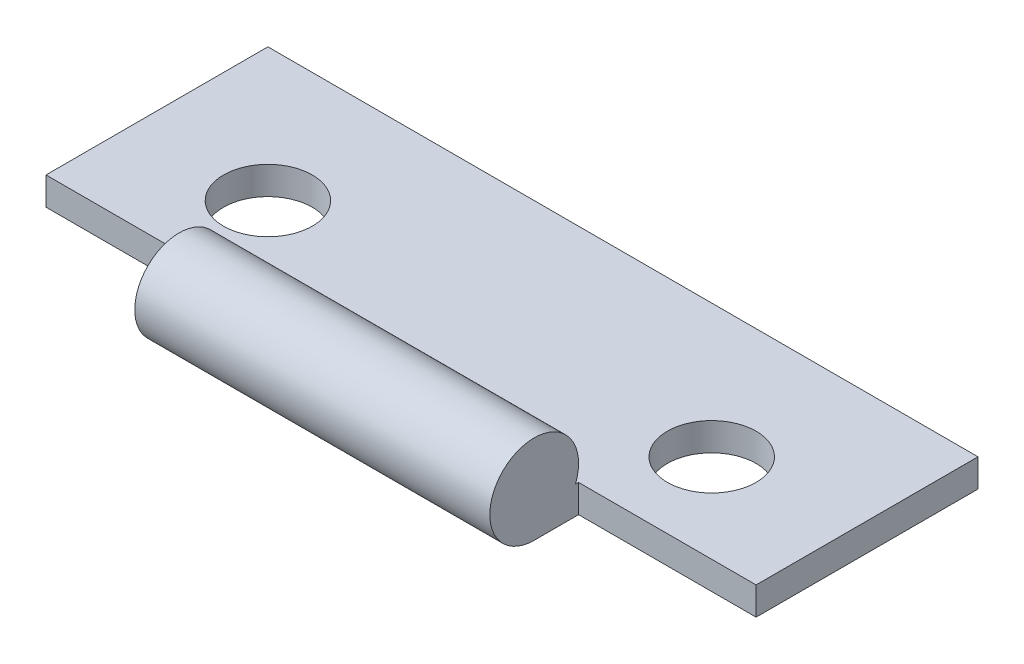
from build123d import *

# Parameters (mm, degrees)
SKETCH1_R           = 1.5875
BOSS_EXTRUDE1_DEPTH = 1
SKETCH2_R           = 1.5875
BOSS_EXTRUDE2_DEPTH = 12.7


with BuildPart() as part:
    # Sketch1 → Boss-Extrude1 (new body)
    with BuildSketch(Plane(origin=(0, 0, 0), x_dir=(1, 0, 0), z_dir=(0, 1, 0))):
        Polygon((25.4, 9.525), (25.4, 1.5875), (19.05, 1.5875), (19.05, 0), (6.35, 0), (6.35, 1.5875), (0, 1.5875), (0, 9.525), align=None)
        with Locations(Location((4.7625, 4.7625, 0), (0, 0, 270))):
            Circle(SKETCH1_R, mode=Mode.SUBTRACT)
        with Locations(Location((20.6375, 4.7625, 0), (0, 0, 90))):
            Circle(SKETCH1_R, mode=Mode.SUBTRACT)
    extrude(amount=BOSS_EXTRUDE1_DEPTH)

    # Sketch2 → Boss-Extrude2 (add)
    with BuildSketch(Plane.ZY.offset(-6.35)):
        with Locations((0, 1.5875)):
            Circle(SKETCH2_R)
    extrude(amount=-BOSS_EXTRUDE2_DEPTH)


solid = part.part
